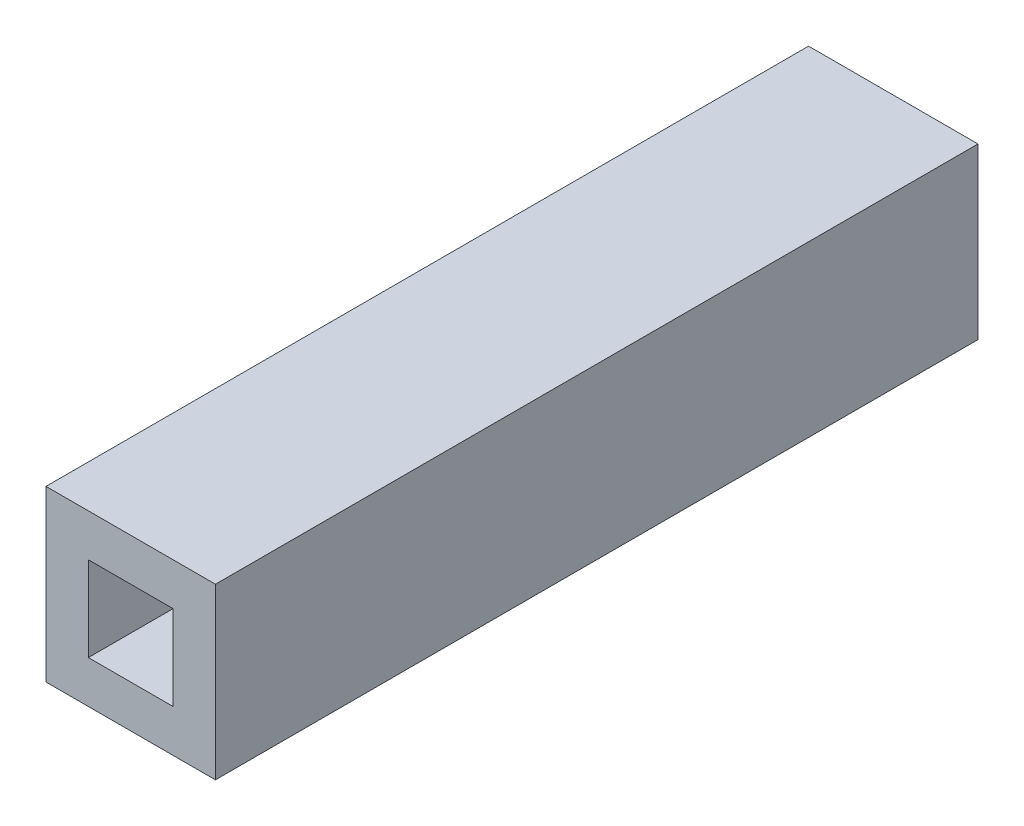
from build123d import *

# Parameters (mm, degrees)
SKETCH1_W           = 20
SKETCH1_H           = 20
SKETCH1_W_2         = 10
SKETCH1_H_2         = 10
EXTRUDE_THIN1_DEPTH = 90


with BuildPart() as part:
    # Sketch1 → Extrude-Thin1 (new body)
    with BuildSketch(Plane.XY):
        Rectangle(SKETCH1_W, SKETCH1_H)
        Rectangle(SKETCH1_W_2, SKETCH1_H_2, mode=Mode.SUBTRACT)
    extrude(amount=EXTRUDE_THIN1_DEPTH)


solid = part.part
